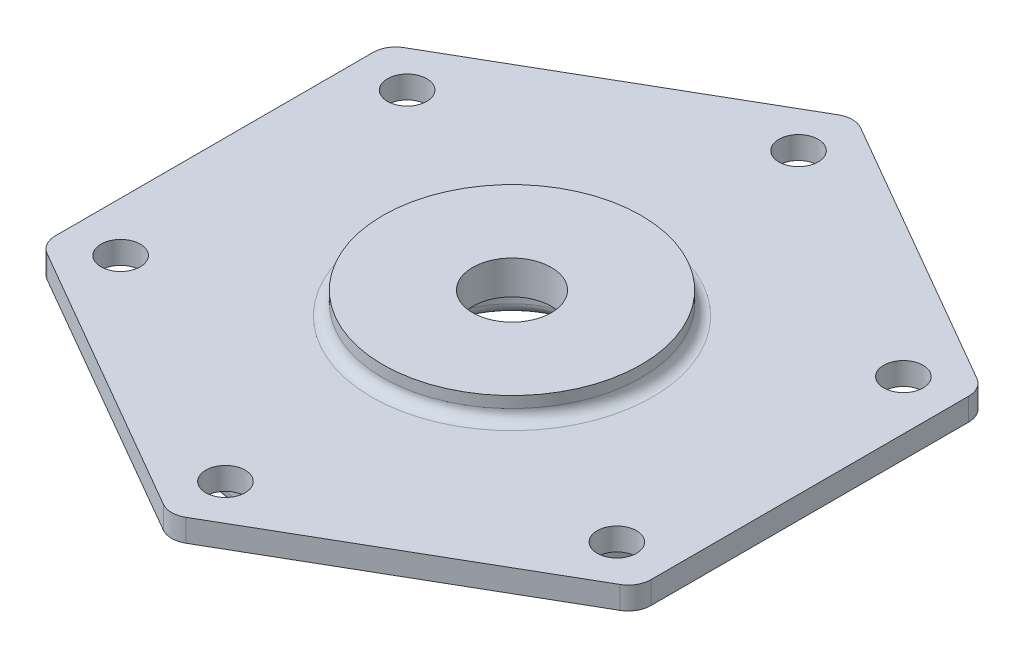
from build123d import *

# Parameters (mm, degrees)
BOSS_EXTRUDE1_DEPTH = 4
SKETCH2_R           = 23
BOSS_EXTRUDE2_DEPTH = 4
SKETCH3_R           = 45
BOSS_EXTRUDE3_DEPTH = 6
SKETCH4_R           = 40
SKETCH4_R_2         = 19
CUT_EXTRUDE1_DEPTH  = 6
SKETCH5_R           = 14
CUT_EXTRUDE2_DEPTH  = 8
SKETCH6_R           = 7
CUT_EXTRUDE3_DEPTH  = 81.888663881
FILLET1_R           = 2
SKETCH7_R           = 3.5
CUT_EXTRUDE4_DEPTH  = 82.110886719


with BuildPart() as part:
    # Sketch1 → Boss-Extrude1 (new body)
    with BuildSketch(Plane(origin=(0, 0, 0), x_dir=(1, 0, 0), z_dir=(0, 1, 0))):
        with BuildLine():
            Line((2, -60.044427996), (51, -31.754264805))
            ThreePointArc((51, -31.754264805), (52.464101615, -30.29016319), (53, -28.29016319))
            Line((53, -28.29016319), (53, 28.29016319))
            ThreePointArc((53, 28.29016319), (52.464101615, 30.29016319), (51, 31.754264805))
            Line((51, 31.754264805), (2, 60.044427996))
            ThreePointArc((2, 60.044427996), (0, 60.580326381), (-2, 60.044427996))
            Line((-2, 60.044427996), (-51, 31.754264805))
            ThreePointArc((-51, 31.754264805), (-52.464101615, 30.29016319), (-53, 28.29016319))
            Line((-53, 28.29016319), (-53, -28.29016319))
            ThreePointArc((-53, -28.29016319), (-52.464101615, -30.29016319), (-51, -31.754264805))
            Line((-51, -31.754264805), (-2, -60.044427996))
            ThreePointArc((-2, -60.044427996), (0, -60.580326381), (2, -60.044427996))
        make_face()
    extrude(amount=BOSS_EXTRUDE1_DEPTH)

    # Sketch2 → Boss-Extrude2 (add)
    with BuildSketch(Plane(origin=(0, 4, 0), x_dir=(1, 0, 0), z_dir=(0, 1, 0))):
        with Locations(Location((0, 0, 0), (0, 0, 270))):
            Circle(SKETCH2_R)
    extrude(amount=BOSS_EXTRUDE2_DEPTH)

    # Sketch3 → Boss-Extrude3 (add)
    with BuildSketch(Plane.XZ):
        with Locations(Location((0, 0, 0), (0, 0, 270))):
            Circle(SKETCH3_R)
    extrude(amount=BOSS_EXTRUDE3_DEPTH)

    # Sketch4 → Cut-Extrude1 (cut)
    with BuildSketch(Plane.XZ.offset(6)):
        with Locations(Location((0, 0, 0), (0, 0, 270))):
            Circle(SKETCH4_R)
        with Locations(Location((0, 0, 0), (0, 0, 270))):
            Circle(SKETCH4_R_2, mode=Mode.SUBTRACT)
    extrude(amount=-CUT_EXTRUDE1_DEPTH, mode=Mode.SUBTRACT)

    # Sketch5 → Cut-Extrude2 (cut)
    with BuildSketch(Plane.XZ.offset(6)):
        with Locations(Location((0, 0, 0), (0, 0, 270))):
            Circle(SKETCH5_R)
    extrude(amount=-CUT_EXTRUDE2_DEPTH, mode=Mode.SUBTRACT)

    # Sketch6 → Cut-Extrude3 (cut, through all)
    with BuildSketch(Plane.XZ.offset(-2)):
        with Locations(Location((0, 0, 0), (0, 0, 270))):
            Circle(SKETCH6_R)
    extrude(amount=-CUT_EXTRUDE3_DEPTH, mode=Mode.SUBTRACT)

    # Fillet1
    fillet1_edges = [part.edges().sort_by_distance(p)[0] for p in [
        (0, 4, -23),
        (0, -6, 45),
        (0, -6, 40),
        (0, -6, 19),
        (0, -6, 14),
    ]]
    fillet(fillet1_edges, radius=FILLET1_R)

    # Sketch7 → Cut-Extrude4 (cut, through all)
    with BuildSketch(Plane(origin=(0, 4, 0), x_dir=(1, 0, 0), z_dir=(0, 1, 0))):
        with Locations(Location((0, 51, 0), (0, 0, 270))):
            Circle(SKETCH7_R)
        with Locations(Location((44.167295593, 25.5, 0), (0, 0, 270))):
            Circle(SKETCH7_R)
        with Locations(Location((44.167295593, -25.5, 0), (0, 0, 270))):
            Circle(SKETCH7_R)
        with Locations(Location((0, -51, 0), (0, 0, 270))):
            Circle(SKETCH7_R)
        with Locations(Location((-44.167295593, -25.5, 0), (0, 0, 270))):
            Circle(SKETCH7_R)
        with Locations(Location((-44.167295593, 25.5, 0), (0, 0, 270))):
            Circle(SKETCH7_R)
    extrude(amount=-CUT_EXTRUDE4_DEPTH, mode=Mode.SUBTRACT)


solid = part.part
